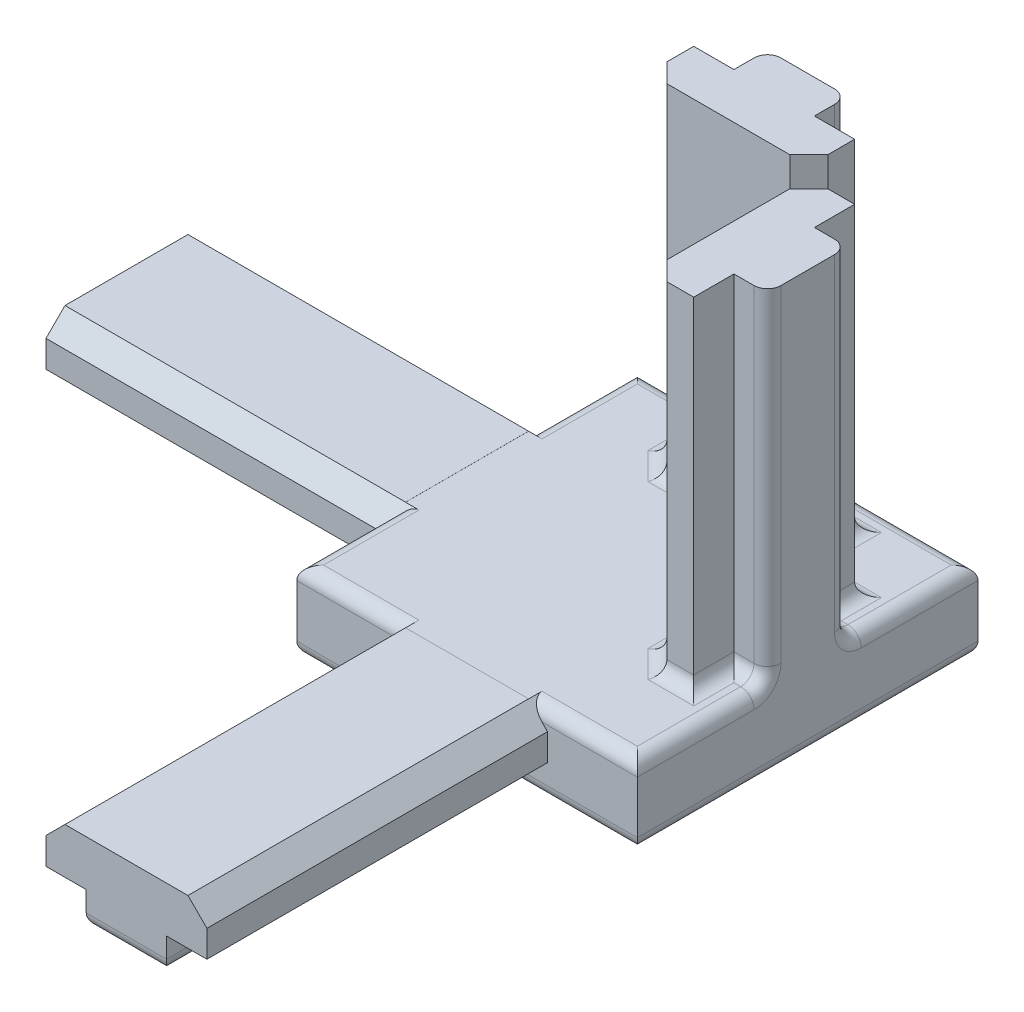
from build123d import *

# Parameters (mm, degrees)
SKETCH1_W           = 25.4
SKETCH1_H           = 25.4
BOSS_EXTRUDE1_DEPTH = 5.91
BOSS_EXTRUDE2_DEPTH = 25.4
BOSS_EXTRUDE3_DEPTH = 25.4
BOSS_EXTRUDE4_DEPTH = 25.4
FILLET2_R           = 1


with BuildPart() as part:
    # Sketch1 → Boss-Extrude1 (new body)
    with BuildSketch(Plane(origin=(0, 0, 0), x_dir=(1, 0, 0), z_dir=(0, 1, 0))):
        Rectangle(SKETCH1_W, SKETCH1_H)
    extrude(amount=BOSS_EXTRUDE1_DEPTH)

    # Sketch2 → Boss-Extrude2 (add)
    with BuildSketch(Plane.XY.offset(12.7)):
        Polygon((-3, 0), (3, 0), (3, 2.5), (6, 2.5), (6, 4.5), (4.585786438, 5.914213562), (-4.585786438, 5.914213562), (-6, 4.5), (-6, 2.5), (-3, 2.5), align=None)
    extrude(amount=BOSS_EXTRUDE2_DEPTH)

    # Sketch3 → Boss-Extrude3 (add)
    with BuildSketch(Plane.ZY.offset(12.7)):
        Polygon((-3, 0), (3, 0), (3, 2.5), (6, 2.5), (6, 4.5), (4.585786438, 5.914213562), (-4.585786438, 5.914213562), (-6, 4.5), (-6, 2.5), (-3, 2.5), align=None)
    extrude(amount=BOSS_EXTRUDE3_DEPTH)

    # Sketch5 → Boss-Extrude4 (add)
    with BuildSketch(Plane(origin=(0, 5.91, 0), x_dir=(1, 0, 0), z_dir=(0, 1, 0))):
        Polygon((3, 12.7), (-3, 12.7), (-3, 10.2), (-6, 10.2), (-6, 8.2), (-4.585786438, 6.785786438), (4.585786438, 6.785786438), (6, 8.2), (6, 10.2), (3, 10.2), align=None)
        Polygon((12.7, -3), (12.7, 3), (10.2, 3), (10.2, 6), (8.2, 6), (6.785786438, 4.585786438), (6.785786438, -4.585786438), (8.2, -6), (10.2, -6), (10.2, -3), align=None)
    extrude(amount=BOSS_EXTRUDE4_DEPTH)

    # Fillet2
    fillet2_edges = [part.edges().sort_by_distance(p)[0] for p in [
        (6.785786438, 5.91, 0),
        (7.492893219, 5.91, 5.292893219),
        (9.2, 5.91, 6),
        (10.2, 5.91, 4.5),
        (11.45, 5.91, 3),
        (12.7, 18.61, 3),
        (-12.7, 5.91, -8.645),
        (7.85, 0, 12.7),
        (8.645, 5.91, 12.7),
        (-8.645, 5.91, 12.7),
        (3, 0, 25.4),
        (-3, 0, 25.4),
        (0, 0, 38.1),
        (-12.7, 0, 7.85),
        (-12.7, 5.91, 8.645),
        (-25.4, 0, 3),
        (12.7, 5.91, 7.85),
        (-7.85, 0, 12.7),
        (-12.7, 0, -7.85),
        (-25.4, 0, -3),
        (-38.1, 0, 0),
        (0, 0, -12.7),
        (12.7, 0, 0),
        (12.7, 5.91, -7.85),
        (-7.85, 5.91, -12.7),
        (-3, 5.91, -11.45),
        (-3, 18.61, -12.7),
        (-4.5, 5.91, -10.2),
        (-6, 5.91, -9.2),
        (-5.292893219, 5.91, -7.492893219),
        (0, 5.91, -6.785786438),
        (5.292893219, 5.91, -7.492893219),
        (6, 5.91, -9.2),
        (4.5, 5.91, -10.2),
        (3, 5.91, -11.45),
        (3, 18.61, -12.7),
        (7.85, 5.91, -12.7),
        (11.45, 5.91, -3),
        (12.7, 18.61, -3),
        (10.2, 5.91, -4.5),
        (9.2, 5.91, -6),
        (7.492893219, 5.91, -5.292893219),
    ]]
    fillet(fillet2_edges, radius=FILLET2_R)


solid = part.part
